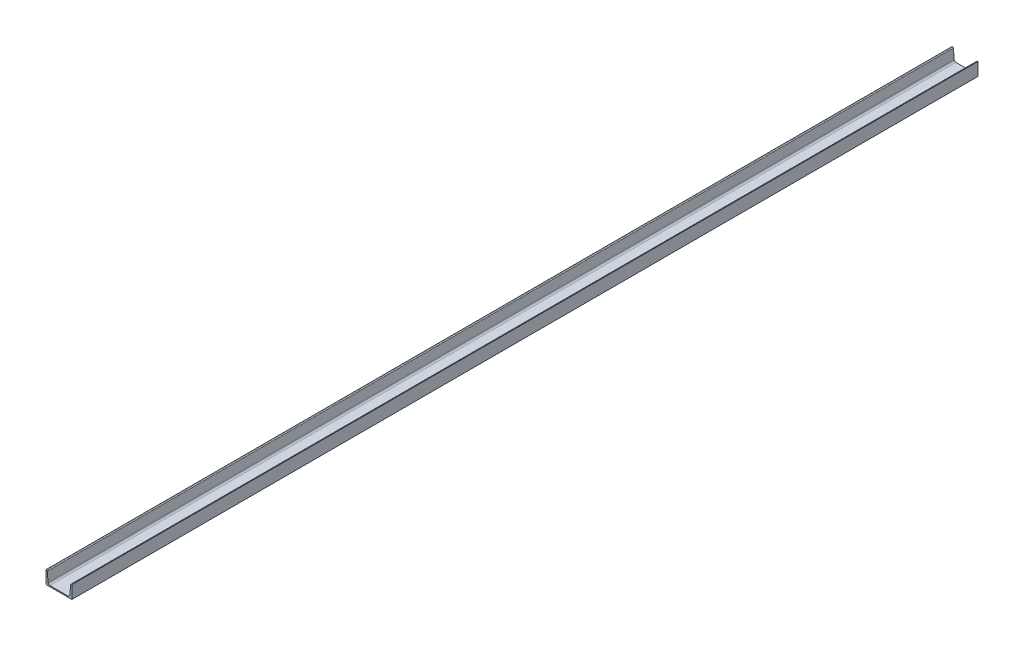
from build123d import *

# Parameters (mm, degrees)
CHANNEL_C_150_X_75_X_6_5_1_DEPTH = 5250


with BuildPart() as part:
    # Sketch11 → Channel C 150 X 75 X 6.5(1) (new body)
    with BuildSketch(Plane.YX.offset(-2625)):
        with BuildLine():
            Line((75, 150), (0, 150))
            Line((0, 150), (0, 0))
            Line((0, 0), (75, 0))
            Line((75, 0), (75, 2.421857404))
            ThreePointArc((75, 2.421857404), (73.686386684, 5.799808442), (70.435778714, 7.402830895))
            Line((70.435778714, 7.402830895), (15.628442573, 12.197851485))
            ThreePointArc((15.628442573, 12.197851485), (9.127226632, 15.40389639), (6.5, 22.159798466))
            Line((6.5, 22.159798466), (6.5, 127.840201534))
            ThreePointArc((6.5, 127.840201534), (9.127226632, 134.59610361), (15.628442573, 137.802148515))
            Line((15.628442573, 137.802148515), (70.435778714, 142.597169105))
            ThreePointArc((70.435778714, 142.597169105), (73.686386684, 144.200191558), (75, 147.578142596))
            Line((75, 147.578142596), (75, 150))
        make_face()
    extrude(amount=CHANNEL_C_150_X_75_X_6_5_1_DEPTH)


solid = part.part
